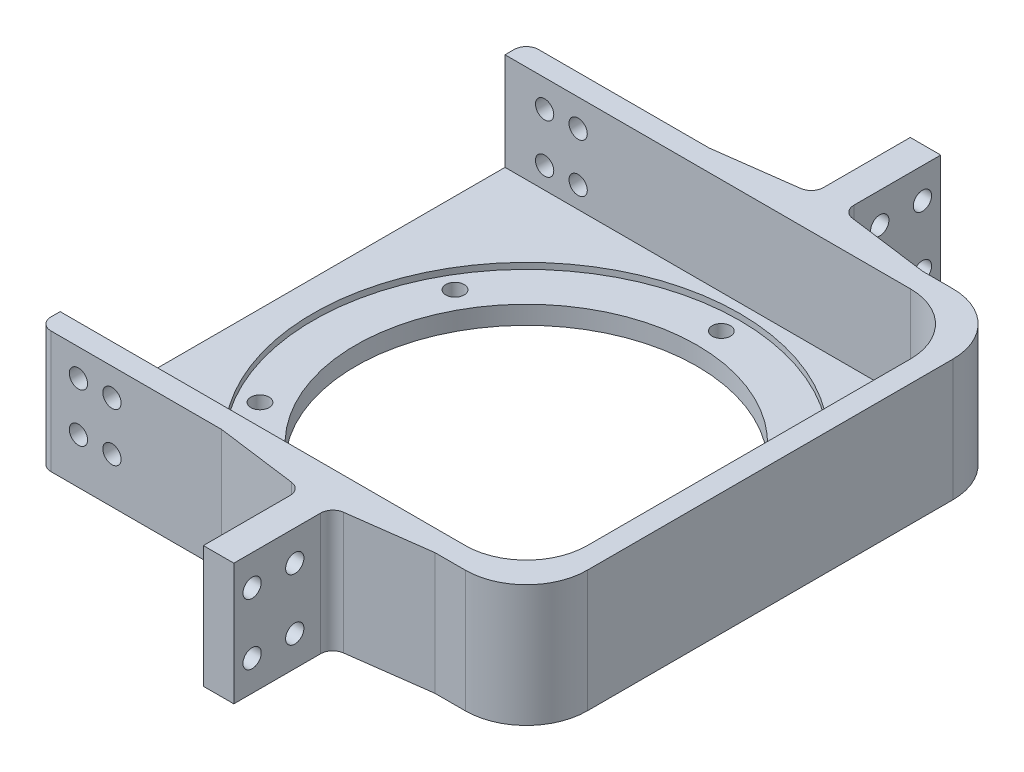
from build123d import *

# Parameters (mm, degrees)
SKETCH_1_W          = 80
SKETCH_1_H          = 80
SKETCH_1_R          = 28
SKETCH_1_R_2        = 1.5
EXTRUDE_1_DEPTH     = 4
EXTRUDE_2_DEPTH     = 16
SKETCH_9_W          = 5
SKETCH_9_H          = 18
EXTRUDE_6_DEPTH     = 20
SKETCH_11_R         = 1.5
CUT_EXTRUDE_2_DEPTH = 80.14543575
CUT_EXTRUDE_START   = -1
SKETCH_12_R         = 35
SKETCH_12_R_2       = 28
CUT_EXTRUDE_3_DEPTH = 1
FILLET_6_R          = 10
SKETCH_13_R         = 1.5
CUT_EXTRUDE_4_DEPTH = 125.322162143
FILLET_8_R          = 2
SKETCH_15_W         = 5
SKETCH_15_H         = 18
CUT_EXTRUDE_6_DEPTH = 74.239333694
EXTRUDE_8_DEPTH     = 20
FILLET_9_R          = 2


with BuildPart() as part:
    # 草图1 → 凸台-拉伸1 (new body)
    with BuildSketch(Plane(origin=(0, 0, 0), x_dir=(1, 0, 0), z_dir=(0, 1, 0))):
        Rectangle(SKETCH_1_W, SKETCH_1_H)
        with Locations(Location((0, 0, 0), (0, 0, 270))):
            Circle(SKETCH_1_R, mode=Mode.SUBTRACT)
        with Locations(Location((0, 32, 0), (0, 0, 270))):
            Circle(SKETCH_1_R_2, mode=Mode.SUBTRACT)
        with Locations(Location((27.712812921, 16, 0), (0, 0, 270))):
            Circle(SKETCH_1_R_2, mode=Mode.SUBTRACT)
        with Locations(Location((27.712812921, -16, 0), (0, 0, 270))):
            Circle(SKETCH_1_R_2, mode=Mode.SUBTRACT)
        with Locations(Location((0, -32, 0), (0, 0, 270))):
            Circle(SKETCH_1_R_2, mode=Mode.SUBTRACT)
        with Locations(Location((-27.712812921, -16, 0), (0, 0, 270))):
            Circle(SKETCH_1_R_2, mode=Mode.SUBTRACT)
        with Locations(Location((-27.712812921, 16, 0), (0, 0, 270))):
            Circle(SKETCH_1_R_2, mode=Mode.SUBTRACT)
    extrude(amount=EXTRUDE_1_DEPTH)

    # 草图2 → 凸台-拉伸2 (add)
    with BuildSketch(Plane(origin=(0, 4, 0), x_dir=(1, 0, 0), z_dir=(0, 1, 0))):
        Polygon((40, 40), (-40, 40), (-40, 36.5), (-36.5, 36.5), (36.5, 36.5), (36.5, -36.5), (-36.5, -36.5), (-40, -36.5), (-40, -40), (40, -40), align=None)
    extrude(amount=EXTRUDE_2_DEPTH)

    # 草图9 → 凸台-拉伸6 (add)
    with BuildSketch(Plane(origin=(0, 20, 0), x_dir=(1, 0, 0), z_dir=(0, 1, 0))):
        with Locations((-7.5, -49)):
            Rectangle(SKETCH_9_W, SKETCH_9_H)
        with Locations((7.5, -49)):
            Rectangle(SKETCH_9_W, SKETCH_9_H)
        with Locations((7.5, 49)):
            Rectangle(SKETCH_9_W, SKETCH_9_H)
        with Locations((-7.5, 49)):
            Rectangle(SKETCH_9_W, SKETCH_9_H)
    extrude(amount=-EXTRUDE_6_DEPTH)

    # 草图11 → 切除-拉伸2 (cut, through all)
    with BuildSketch(Plane.ZY.offset(10)):
        with Locations((55, 15)):
            Circle(SKETCH_11_R)
        with Locations((55, 5)):
            Circle(SKETCH_11_R)
        with Locations((48, 5)):
            Circle(SKETCH_11_R)
        with Locations((48, 15)):
            Circle(SKETCH_11_R)
        with Locations(Location((-48, 15, 0), (0, 0, 180))):
            Circle(SKETCH_11_R)
        with Locations(Location((-48, 5, 0), (0, 0, 180))):
            Circle(SKETCH_11_R)
        with Locations(Location((-55, 5, 0), (0, 0, 180))):
            Circle(SKETCH_11_R)
        with Locations(Location((-55, 15, 0), (0, 0, 180))):
            Circle(SKETCH_11_R)
    extrude(amount=-CUT_EXTRUDE_2_DEPTH, mode=Mode.SUBTRACT)

    # 草图12 → 切除-拉伸3 (cut)
    with BuildSketch(Plane(origin=(0, 4, 0), x_dir=(1, 0, 0), z_dir=(0, 1, 0)).offset(CUT_EXTRUDE_START)):
        with Locations(Location((0, 0, 0), (0, 0, 270))):
            Circle(SKETCH_12_R)
        with Locations(Location((0, 0, 0), (0, 0, 270))):
            Circle(SKETCH_12_R_2, mode=Mode.SUBTRACT)
    extrude(amount=CUT_EXTRUDE_3_DEPTH, mode=Mode.SUBTRACT)

    # 圆角6
    fillet_6_edges = [part.edges().sort_by_distance(p)[0] for p in [
        (36.5, 12, -36.5),
        (36.5, 12, 36.5),
        (40, 10, -40),
        (40, 10, 40),
    ]]
    fillet(fillet_6_edges, radius=FILLET_6_R)

    # 草图13 → 切除-拉伸4 (cut, through all)
    with BuildSketch(Plane.XY.offset(58)):
        with Locations((-33.5, 7.5)):
            Circle(SKETCH_13_R)
        with Locations((-28, 7.5)):
            Circle(SKETCH_13_R)
        with Locations((-33.5, 15.5)):
            Circle(SKETCH_13_R)
        with Locations((-28, 15.5)):
            Circle(SKETCH_13_R)
    extrude(amount=-CUT_EXTRUDE_4_DEPTH, mode=Mode.SUBTRACT)

    # 圆角8
    fillet_8_edges = [part.edges().sort_by_distance(p)[0] for p in [
        (-40, 10, -40),
        (-40, 10, 40),
    ]]
    fillet(fillet_8_edges, radius=FILLET_8_R)

    # 草图15 → 切除-拉伸6 (cut, through all)
    with BuildSketch(Plane(origin=(0, 20, 0), x_dir=(1, 0, 0), z_dir=(0, 1, 0))):
        with Locations((-7.5, -49)):
            Rectangle(SKETCH_15_W, SKETCH_15_H)
        with Locations((-7.5, 49)):
            Rectangle(SKETCH_15_W, SKETCH_15_H)
    extrude(amount=-CUT_EXTRUDE_6_DEPTH, mode=Mode.SUBTRACT)

    # 草图16 → 凸台-拉伸8 (add)
    with BuildSketch(Plane(origin=(0, 20, 0), x_dir=(1, 0, 0), z_dir=(0, 1, 0))):
        Polygon((10, -42), (25, -40), (10, -40), align=None)
        Polygon((5, -42), (5, -40), (-10, -40), align=None)
        Polygon((10, 42), (10, 40), (25, 40), align=None)
        Polygon((5, 42), (-10, 40), (5, 40), align=None)
    extrude(amount=-EXTRUDE_8_DEPTH)

    # 圆角9
    fillet_9_edges = [part.edges().sort_by_distance(p)[0] for p in [
        (10, 10, 42),
        (5, 10, 42),
        (10, 10, -42),
        (5, 10, -42),
    ]]
    fillet(fillet_9_edges, radius=FILLET_9_R)


solid = part.part
